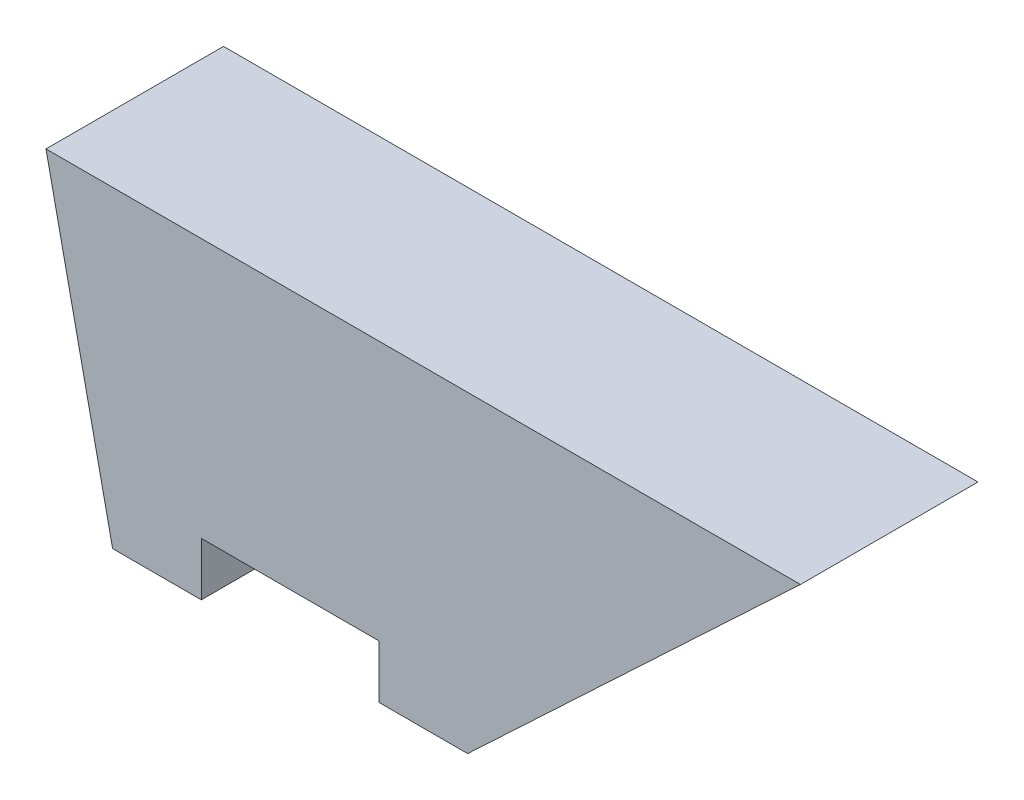
from build123d import *

# Parameters (mm, degrees)
ESTRUSIONE_ESTRUSIONE1_DEPTH = 4


with BuildPart() as part:
    # Schizzo1 → Estrusione-Estrusione1 (new body)
    with BuildSketch(Plane.XY):
        Polygon((-1.5, 7.05), (15.5, 7.05), (8, 0), (6, 0), (6, 1.2), (2, 1.2), (2, 0), (0, 0), align=None)
    extrude(amount=ESTRUSIONE_ESTRUSIONE1_DEPTH)


solid = part.part
